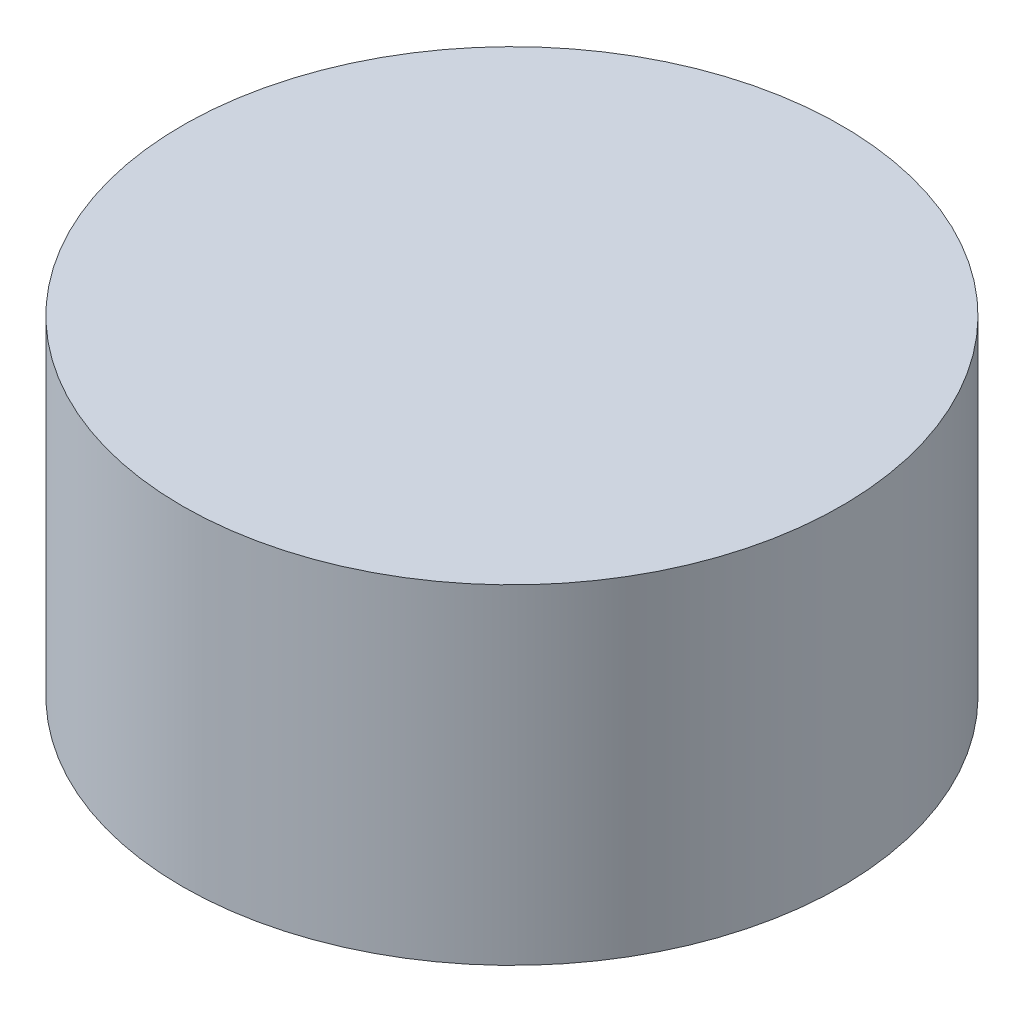
from build123d import *

# Parameters (mm, degrees)
SKETCH1_R           = 6.35
BOSS_EXTRUDE1_DEPTH = 6.35


with BuildPart() as part:
    # Sketch1 → Boss-Extrude1 (new body)
    with BuildSketch(Plane(origin=(0, 0, 0), x_dir=(1, 0, 0), z_dir=(0, 1, 0))):
        with Locations(Location((0, 0, 0), (0, 0, 270))):
            Circle(SKETCH1_R)
    extrude(amount=BOSS_EXTRUDE1_DEPTH)


solid = part.part
